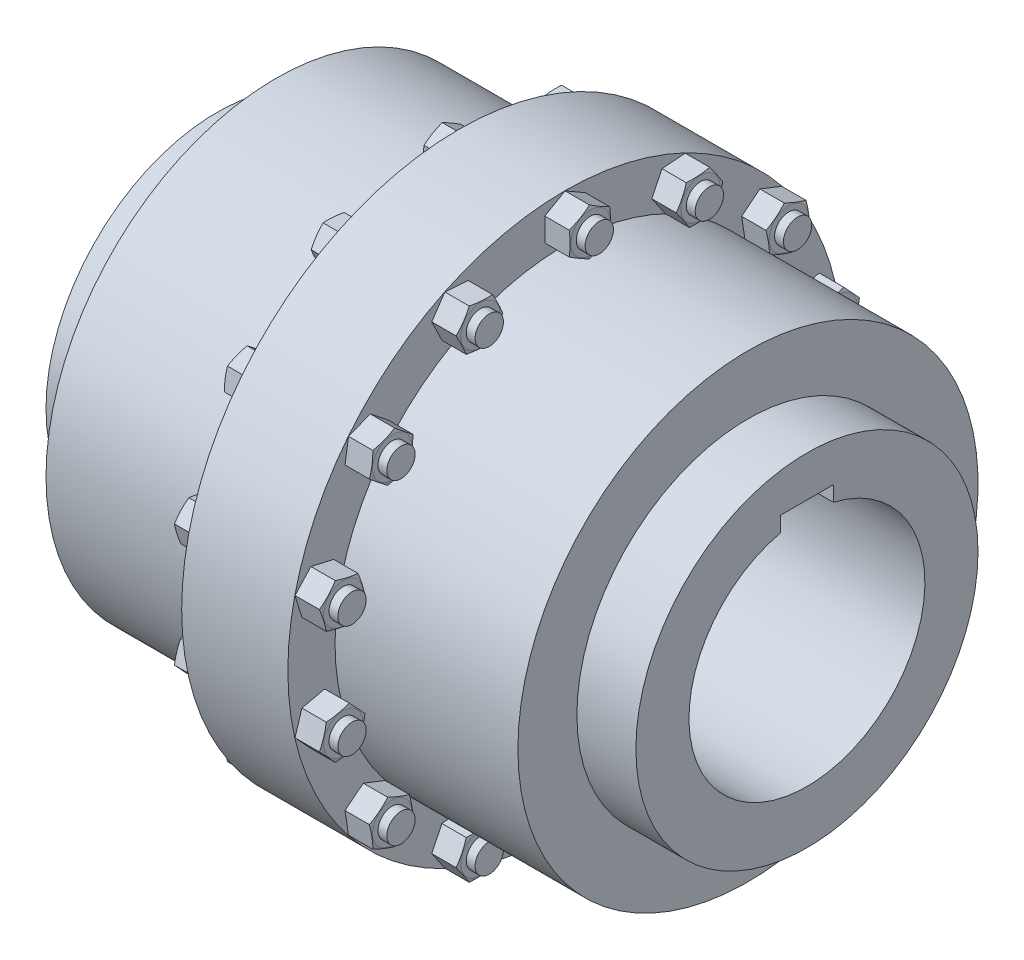
from build123d import *

# Parameters (mm, degrees)
SKETCH_1_W               = 54
SKETCH_1_H               = 27.5
CUT_EXTRUDE_1_DEPTH      = 416.872576639
CUT_EXTRUDE_1_DEPTH_BACK = 416.872576639
SKETCH_3_W               = 45
SKETCH_3_H               = 110.4
CUT_EXTRUDE_2_DEPTH      = 15
CUT_EXTRUDE_START        = -21.5
CUT_EXTRUDE_3_DEPTH      = 21.5
PATTERN_CIRCULAR_1_COUNT = 14


with BuildPart() as part:
    # Эскиз1 → Повернуть1 (revolve)
    with BuildSketch(Plane.XY, mode=Mode.PRIVATE) as revolve_1_sk:
        Polygon((-250, 100), (-250, 145), (-200, 145), (-200, 195), (-45, 195), (-45, 235), (45, 235), (45, 195), (200, 195), (200, 145), (250, 145), (250, 100), (10, 100), (10, 145), (105, 145), (105, 172.5), (-105, 172.5), (-105, 145), (-10, 145), (-10, 100), align=None)
        with Locations((-172, 158.75)):
            Rectangle(SKETCH_1_W, SKETCH_1_H, mode=Mode.SUBTRACT)
        with Locations((172, 158.75)):
            Rectangle(SKETCH_1_W, SKETCH_1_H, mode=Mode.SUBTRACT)
    revolve(revolve_1_sk.sketch.rotate(Axis((-98.607085032, 0, 0), (1, 0, 0)), 90), axis=Axis((-98.607085032, 0, 0), (1, 0, 0)))

    # Эскиз3 → Вырез-Вытянуть1 (cut, two sides: drawn at the far end of the back side and taken through both)
    with BuildSketch(Plane(origin=(0, 0, 0), x_dir=(0, 0, -1), z_dir=(1, 0, 0)).offset(-CUT_EXTRUDE_1_DEPTH_BACK)):
        with Locations((0, 55.2)):
            Rectangle(SKETCH_3_W, SKETCH_3_H)
    extrude(amount=CUT_EXTRUDE_1_DEPTH + CUT_EXTRUDE_1_DEPTH_BACK, mode=Mode.SUBTRACT)

    # Эскиз2 → Повернуть2 (revolve)
    with BuildSketch(Plane.XY, mode=Mode.PRIVATE) as revolve_2_sk:
        Polygon((-60, 215), (74, 215), (74, 227), (66.5, 227), (66.5, 231.6), (65.642562584, 234.8), (45, 234.8), (45, 227), (-45, 227), (-45, 232.9), (-59.062177826, 232.9), (-60, 229.4), align=None)
    revolve_2 = revolve(revolve_2_sk.sketch.rotate(Axis((-60, 215, 0), (1, 0, 0)), 90), axis=Axis((-60, 215, 0), (1, 0, 0)))

    # Эскиз5 → Вырез-Вытянуть2 (cut)
    with BuildSketch(Plane.ZY.offset(60)):
        with BuildLine():
            Line((15.501854728, 206.05), (0, 197.1))
            ThreePointArc((0, 197.1), (8.95, 199.498145272), (15.501854728, 206.05))
        make_face()
        with BuildLine():
            ThreePointArc((-15.501854728, 206.05), (-8.95, 199.498145272), (0, 197.1))
            Line((0, 197.1), (-15.501854728, 206.05))
        make_face()
        with BuildLine():
            Line((15.501854728, 223.95), (15.501854728, 206.05))
            ThreePointArc((15.501854728, 206.05), (17.290072291, 210.367139093), (17.9, 215))
            ThreePointArc((17.9, 215), (17.290072291, 219.632860907), (15.501854728, 223.95))
        make_face()
        with BuildLine():
            Line((0, 232.9), (15.501854728, 223.95))
            ThreePointArc((15.501854728, 223.95), (8.95, 230.501854728), (0, 232.9))
        make_face()
        with BuildLine():
            ThreePointArc((0, 232.9), (-8.95, 230.501854728), (-15.501854728, 223.95))
            Line((-15.501854728, 223.95), (0, 232.9))
        make_face()
        with BuildLine():
            ThreePointArc((-15.501854728, 223.95), (-17.9, 215), (-15.501854728, 206.05))
            Line((-15.501854728, 206.05), (-15.501854728, 223.95))
        make_face()
    cut_extrude_2 = extrude(amount=-CUT_EXTRUDE_2_DEPTH, mode=Mode.SUBTRACT)

    # Эскиз6 → Вырез-Вытянуть3 (cut)
    with BuildSketch(Plane(origin=(66.5, 0, 0), x_dir=(0, 0, -1), z_dir=(1, 0, 0)).offset(CUT_EXTRUDE_START)):
        with BuildLine():
            Line((17.147302995, 205.1), (0, 195.2))
            ThreePointArc((0, 195.2), (9.9, 197.852697005), (17.147302995, 205.1))
        make_face()
        with BuildLine():
            ThreePointArc((-17.147302995, 205.1), (-9.9, 197.852697005), (0, 195.2))
            Line((0, 195.2), (-17.147302995, 205.1))
        make_face()
        with BuildLine():
            Line((17.147302995, 224.9), (17.147302995, 205.1))
            ThreePointArc((17.147302995, 205.1), (19.125331361, 209.875382907), (19.8, 215))
            ThreePointArc((19.8, 215), (19.125331361, 220.124617093), (17.147302995, 224.9))
        make_face()
        with BuildLine():
            Line((0, 234.8), (17.147302995, 224.9))
            ThreePointArc((17.147302995, 224.9), (9.9, 232.147302995), (0, 234.8))
        make_face()
        with BuildLine():
            ThreePointArc((0, 234.8), (-9.9, 232.147302995), (-17.147302995, 224.9))
            Line((-17.147302995, 224.9), (0, 234.8))
        make_face()
        with BuildLine():
            ThreePointArc((-17.147302995, 224.9), (-19.8, 215), (-17.147302995, 205.1))
            Line((-17.147302995, 205.1), (-17.147302995, 224.9))
        make_face()
    cut_extrude_3 = extrude(amount=CUT_EXTRUDE_3_DEPTH, mode=Mode.SUBTRACT)

    # Круговой массив1: Повернуть2, Вырез-Вытянуть2, Вырез-Вытянуть3 ×14 about axis
    pattern_circular_1_axis = Axis((0, 0, 0), (1, 0, 0))
    add([revolve_2.rotate(pattern_circular_1_axis, i * 360 / PATTERN_CIRCULAR_1_COUNT) for i in range(1, PATTERN_CIRCULAR_1_COUNT)])
    add([cut_extrude_2.rotate(pattern_circular_1_axis, i * 360 / PATTERN_CIRCULAR_1_COUNT) for i in range(1, PATTERN_CIRCULAR_1_COUNT)], mode=Mode.SUBTRACT)
    add([cut_extrude_3.rotate(pattern_circular_1_axis, i * 360 / PATTERN_CIRCULAR_1_COUNT) for i in range(1, PATTERN_CIRCULAR_1_COUNT)], mode=Mode.SUBTRACT)


solid = part.part
